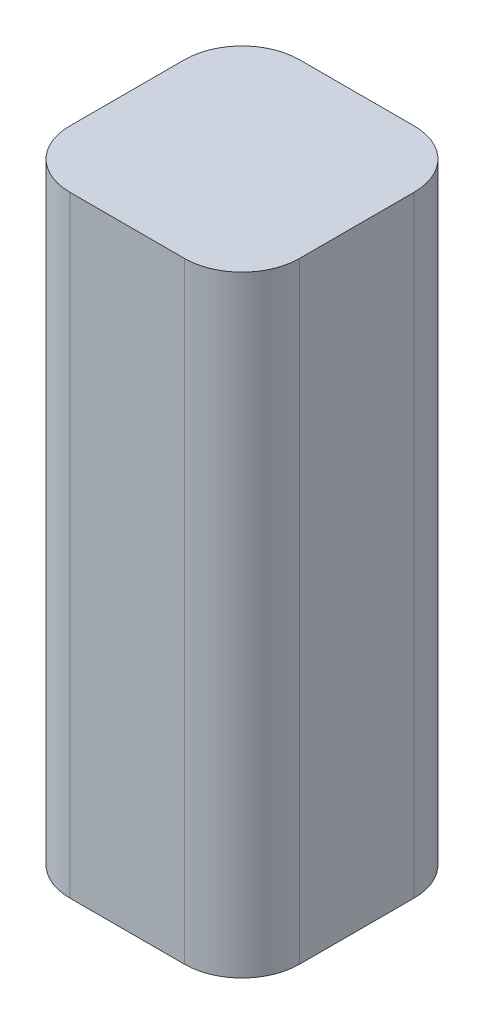
from build123d import *

# Parameters (mm, degrees)
SKETCH_1_W          = 8
SKETCH_1_H          = 8
SKETCH_1_R          = 3.05
EXTRUDE_1_DEPTH     = 8.8
SKETCH_2_W          = 8
SKETCH_2_H          = 4.5
EXTRUDE_2_DEPTH     = 8.8
SKETCH_3_R          = 3.05
CUT_EXTRUDE_1_DEPTH = 11.792590051
SKETCH_4_W          = 8
SKETCH_4_H          = 0.8
CUT_EXTRUDE_2_DEPTH = 11.792590051
SKETCH_5_W          = 2.614851978
SKETCH_5_H          = 0.8
CUT_EXTRUDE_3_DEPTH = 6
SKETCH_8_W          = 8
SKETCH_8_H          = 8
EXTRUDE_3_DEPTH     = 8
FILLET_2_R          = 2


with BuildPart() as part:
    # 草圖1 → 填料-伸長1 (new body)
    with BuildSketch(Plane(origin=(0, 0, 0), x_dir=(1, 0, 0), z_dir=(0, 1, 0))):
        Rectangle(SKETCH_1_W, SKETCH_1_H)
        with Locations(Location((0, 0, 0), (0, 0, 270))):
            Circle(SKETCH_1_R, mode=Mode.SUBTRACT)
    extrude(amount=EXTRUDE_1_DEPTH)

    # 草圖2 → 填料-伸長2 (add)
    with BuildSketch(Plane(origin=(0, 0, -4), x_dir=(-1, 0, 0), z_dir=(0, 0, -1))):
        with Locations((0, 11.05)):
            Rectangle(SKETCH_2_W, SKETCH_2_H)
    extrude(amount=-EXTRUDE_2_DEPTH)

    # 草圖3 → 除料-伸長1 (cut, through all)
    with BuildSketch(Plane.XZ.offset(-8.8)):
        with Locations(Location((0, 0, 0), (0, 0, 270))):
            Circle(SKETCH_3_R)
    extrude(amount=-CUT_EXTRUDE_1_DEPTH, mode=Mode.SUBTRACT)

    # 草圖4 → 除料-伸長2 (cut, through all)
    with BuildSketch(Plane.XZ.offset(-8.8)):
        with Locations((0, 4.4)):
            Rectangle(SKETCH_4_W, SKETCH_4_H)
    extrude(amount=-CUT_EXTRUDE_2_DEPTH, mode=Mode.SUBTRACT)

    # 草圖5 → 除料-伸長3 (cut)
    with BuildSketch(Plane.ZY.offset(4)):
        with Locations((0, 12.4)):
            Rectangle(SKETCH_5_W, SKETCH_5_H)
    extrude(amount=-CUT_EXTRUDE_3_DEPTH, mode=Mode.SUBTRACT)

    # 草圖8 → 填料-伸長3 (add)
    with BuildSketch(Plane(origin=(0, 13.3, 0), x_dir=(1, 0, 0), z_dir=(0, 1, 0))):
        Rectangle(SKETCH_8_W, SKETCH_8_H)
    extrude(amount=EXTRUDE_3_DEPTH)

    # 圓角2
    fillet_2_edges = [part.edges().sort_by_distance(p)[0] for p in [
        (4, 10.65, 4),
        (-4, 10.65, 4),
        (-4, 10.65, -4),
        (4, 10.65, -4),
    ]]
    fillet(fillet_2_edges, radius=FILLET_2_R)


solid = part.part
